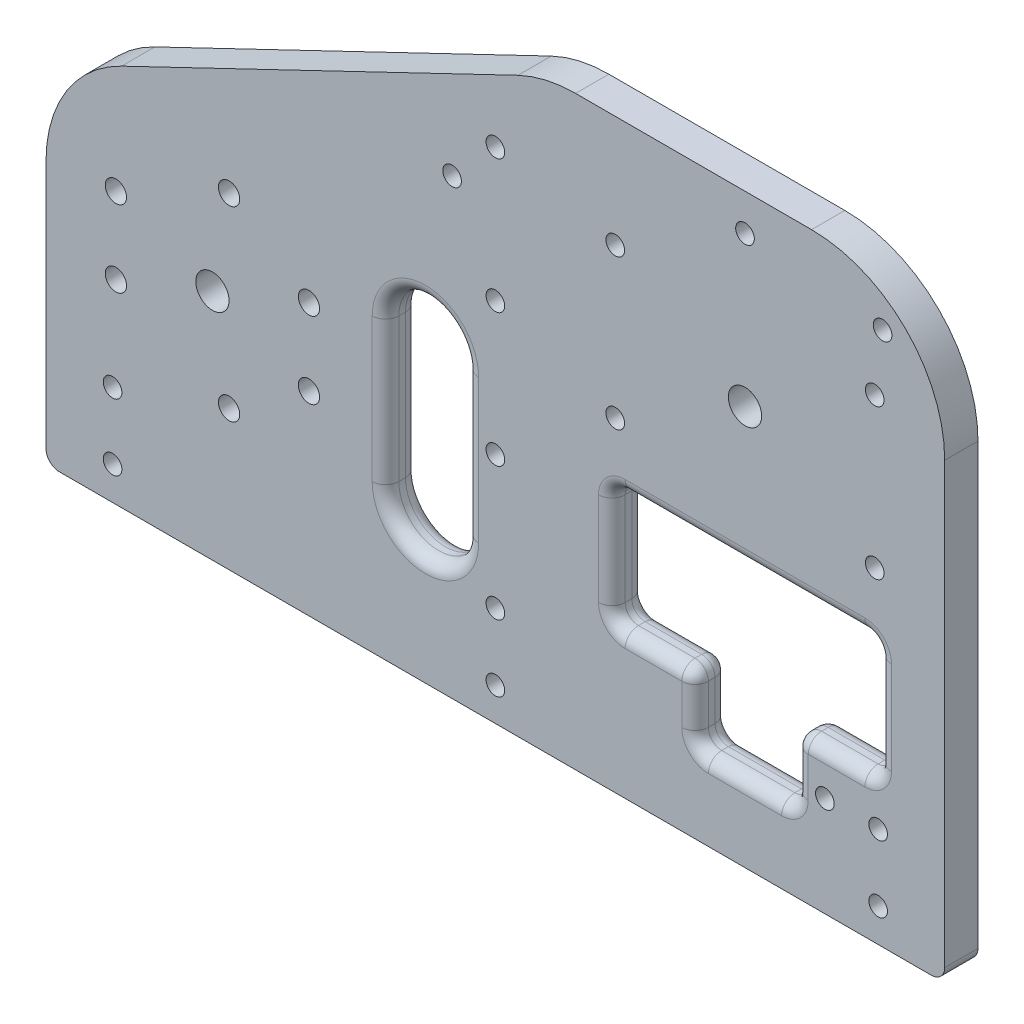
from build123d import *

# Parameters (mm, degrees)
SKETCH1_W           = 135
SKETCH1_H           = 135
SKETCH1_R           = 2.5
BOSS_EXTRUDE1_DEPTH = 5
SKETCH2_R           = 1.4
SKETCH2_R_2         = 1.6
CUT_EXTRUDE1_DEPTH  = 191.984292548
SKETCH4_W           = 480.511739947
SKETCH4_H           = 351.288945528
CUT_EXTRUDE2_DEPTH  = 191.984292548
CUT_EXTRUDE4_DEPTH  = 162.226548682
FILLET1_R           = 20
SKETCH5_R           = 1.4
CUT_EXTRUDE3_DEPTH  = 162.226548682
CUT_EXTRUDE5_DEPTH  = 162.226548682
FILLET2_R           = 2
SKETCH9_R           = 1.4
CUT_EXTRUDE6_DEPTH  = 162.226548682


with BuildPart() as part:
    # Sketch1 → Boss-Extrude1 (new body)
    with BuildSketch(Plane.XY):
        with Locations((-67.5, 67.5)):
            Rectangle(SKETCH1_W, SKETCH1_H)
        with Locations((-110, 35)):
            Circle(SKETCH1_R, mode=Mode.SUBTRACT)
        with Locations((-30, 60)):
            Circle(SKETCH1_R, mode=Mode.SUBTRACT)
    extrude(amount=BOSS_EXTRUDE1_DEPTH)

    # Sketch2 → Cut-Extrude1 (cut, through all)
    with BuildSketch(Plane(origin=(0, 0, 0), x_dir=(-1, 0, 0), z_dir=(0, 0, -1))):
        with Locations((30, 82.5)):
            Circle(SKETCH2_R)
        with Locations((49.485571585, 71.25)):
            Circle(SKETCH2_R)
        with Locations((49.485571585, 48.75)):
            Circle(SKETCH2_R)
        with Locations((10.514428415, 48.75)):
            Circle(SKETCH2_R)
        with Locations((10.514428415, 71.25)):
            Circle(SKETCH2_R)
        with Locations((95.5, 40.75)):
            Circle(SKETCH2_R_2)
        with Locations((107.5, 49)):
            Circle(SKETCH2_R_2)
        with Locations((124.5, 40.75)):
            Circle(SKETCH2_R_2)
        with Locations((124.5, 29.25)):
            Circle(SKETCH2_R_2)
        with Locations((107.5, 21)):
            Circle(SKETCH2_R_2)
        with Locations((95.5, 29.25)):
            Circle(SKETCH2_R_2)
    extrude(amount=-CUT_EXTRUDE1_DEPTH, mode=Mode.SUBTRACT)

    # Sketch4 → Cut-Extrude2 (cut, through all)
    with BuildSketch(Plane.XY.offset(5)):
        with Locations((-51.217905337, 23.305604751)):
            Rectangle(SKETCH4_W, SKETCH4_H)
        Polygon((-12, 0), (0, 0), (0, 88), (-60, 88), (-135, 52), (-135, 0), (-85, 0), align=None, mode=Mode.SUBTRACT)
    extrude(amount=-CUT_EXTRUDE2_DEPTH, mode=Mode.SUBTRACT)

    # Sketch7 → Cut-Extrude4 (cut, through all)
    with BuildSketch(Plane.XY.offset(5)):
        Polygon((-10, 21.5), (-22.5, 21.5), (-22.5, 11.5), (-37.5, 11.5), (-37.5, 21.5), (-50, 21.5), (-50, 39.5), (-10, 39.5), align=None)
    extrude(amount=-CUT_EXTRUDE4_DEPTH, mode=Mode.SUBTRACT)

    # Fillet1
    fillet1_edges = [part.edges().sort_by_distance(p)[0] for p in [
        (-135, 52, 2.5),
        (-60, 88, 2.5),
        (0, 88, 2.5),
    ]]
    fillet(fillet1_edges, radius=FILLET1_R)

    # Sketch5 → Cut-Extrude3 (cut, through all)
    with BuildSketch(Plane.XY.offset(5)):
        with Locations((-125, 15)):
            Circle(SKETCH5_R)
        with Locations((-125, 5)):
            Circle(SKETCH5_R)
        with Locations((-67.5, 5)):
            Circle(SKETCH5_R)
        with Locations((-67.5, 15)):
            Circle(SKETCH5_R)
        with Locations(Location((-10, 5, 0), (0, 0, 180))):
            Circle(SKETCH5_R)
        with Locations(Location((-10, 15, 0), (0, 0, 180))):
            Circle(SKETCH5_R)
        with Locations((-67.5, 35)):
            Circle(SKETCH5_R)
        with Locations((-67.5, 55)):
            Circle(SKETCH5_R)
        with Locations((-67.5, 75)):
            Circle(SKETCH5_R)
        with Locations((-9.333025476, 80.271916037)):
            Circle(SKETCH5_R)
    extrude(amount=-CUT_EXTRUDE3_DEPTH, mode=Mode.SUBTRACT)

    # Sketch8 → Cut-Extrude5 (cut, through all)
    with BuildSketch(Plane.XY.offset(5)):
        with BuildLine():
            Line((-72, 43.769459703), (-72, 22.230540297))
            ThreePointArc((-72, 22.230540297), (-78, 16.230540297), (-84, 22.230540297))
            Line((-84, 22.230540297), (-84, 43.769459703))
            ThreePointArc((-84, 43.769459703), (-78, 49.769459703), (-72, 43.769459703))
        make_face()
    extrude(amount=-CUT_EXTRUDE5_DEPTH, mode=Mode.SUBTRACT)

    # Fillet2
    fillet2_edges = [part.edges().sort_by_distance(p)[0] for p in [
        (-10, 30.5, 0),
        (-10, 39.5, 2.5),
        (-16.25, 21.5, 0),
        (-10, 21.5, 2.5),
        (-22.5, 16.5, 0),
        (-22.5, 21.5, 2.5),
        (-30, 11.5, 0),
        (-22.5, 11.5, 2.5),
        (-37.5, 16.5, 0),
        (-37.5, 11.5, 2.5),
        (-43.75, 21.5, 0),
        (-37.5, 21.5, 2.5),
        (-50, 30.5, 0),
        (-50, 21.5, 2.5),
        (-30, 39.5, 0),
        (-50, 39.5, 2.5),
        (-10, 30.5, 5),
        (-30, 39.5, 5),
        (-50, 30.5, 5),
        (-43.75, 21.5, 5),
        (-37.5, 16.5, 5),
        (-30, 11.5, 5),
        (-22.5, 16.5, 5),
        (-16.25, 21.5, 5),
        (-78, 49.769459703, 0),
        (-72, 33, 0),
        (-78, 16.230540297, 0),
        (-84, 33, 0),
        (-78, 49.769459703, 5),
        (-84, 33, 5),
        (-78, 16.230540297, 5),
        (-72, 33, 5),
        (0, 0, 2.5),
        (-135, 0, 2.5),
    ]]
    fillet(fillet2_edges, radius=FILLET2_R)

    # Sketch9 → Cut-Extrude6 (cut, through all)
    with BuildSketch(Plane.XY.offset(5)):
        with Locations((-18, 15)):
            Circle(SKETCH9_R)
        with Locations((-74, 68)):
            Circle(SKETCH9_R)
    extrude(amount=-CUT_EXTRUDE6_DEPTH, mode=Mode.SUBTRACT)


solid = part.part
